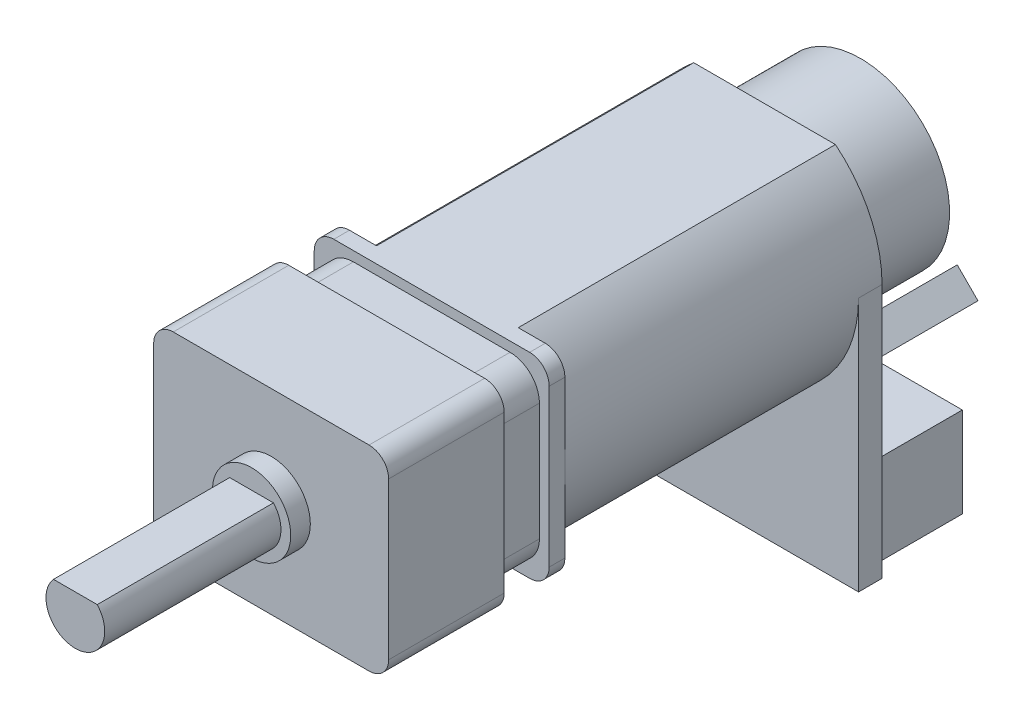
from build123d import *

# Parameters (mm, degrees)
MOTOR_DEPTH           = 15
GEARBOX_DEPTH         = 9
CUT_EXTRUDE1_START    = 0.8
SKETCH6_OUTSIDE_W     = 19.728
SKETCH6_OUTSIDE_H     = 17.728
CUT_EXTRUDE1_DEPTH    = 2.3
SKETCH5_R             = 2
GEARBOX_BEARING_DEPTH = 1
SHAFT_START           = 1
SHAFT_DEPTH           = 9
ENCODER_BASE_START    = -6.1
ENCODER_BASE_DEPTH    = 6.1
SKETCH7_OUTSIDE_W     = 23.112
SKETCH7_OUTSIDE_H     = 29.112
SKETCH7_OUTSIDE_R     = 4.55
SKETCH7_OUTSIDE_W_2   = 10.4
SKETCH7_OUTSIDE_H_2   = 4.6
CUT_EXTRUDE3_DEPTH    = 4.9
SKETCH8_W             = 9.6
SKETCH8_H             = 4.1
CUT_EXTRUDE4_DEPTH    = 3.84


with BuildPart() as part:
    # Sketch1 → motor (new body)
    with BuildSketch(Plane.XY):
        with BuildLine():
            Line((-3.62, 5), (3.62, 5))
            ThreePointArc((3.62, 5), (6, 0), (3.62, -5))
            Line((3.62, -5), (-3.62, -5))
            ThreePointArc((-3.62, -5), (-6, 0), (-3.62, 5))
        make_face()
    extrude(amount=MOTOR_DEPTH)

    # Sketch3 → gearbox (add)
    with BuildSketch(Plane.XY.offset(15)):
        with BuildLine():
            Line((-5, -5), (5, -5))
            ThreePointArc((5, -5), (5.707106781, -4.707106781), (6, -4))
            Line((6, -4), (6, 4))
            ThreePointArc((6, 4), (5.707106781, 4.707106781), (5, 5))
            Line((5, 5), (-5, 5))
            ThreePointArc((-5, 5), (-5.707106781, 4.707106781), (-6, 4))
            Line((-6, 4), (-6, -4))
            ThreePointArc((-6, -4), (-5.707106781, -4.707106781), (-5, -5))
        make_face()
    extrude(amount=GEARBOX_DEPTH)

    # Sketch6 outside → Cut-Extrude1 (cut)
    with BuildSketch(Plane.XY.offset(15).offset(CUT_EXTRUDE1_START)):
        Rectangle(SKETCH6_OUTSIDE_W, SKETCH6_OUTSIDE_H)
        with BuildLine():
            Line((-4, 4.5), (4, 4.5))
            ThreePointArc((4, 4.5), (5.060660172, 4.060660172), (5.5, 3))
            Line((5.5, 3), (5.5, -3))
            ThreePointArc((5.5, -3), (5.060660172, -4.060660172), (4, -4.5))
            Line((4, -4.5), (-4, -4.5))
            ThreePointArc((-4, -4.5), (-5.060660172, -4.060660172), (-5.5, -3))
            Line((-5.5, -3), (-5.5, 3))
            ThreePointArc((-5.5, 3), (-5.060660172, 4.060660172), (-4, 4.5))
        make_face(mode=Mode.SUBTRACT)
    extrude(amount=CUT_EXTRUDE1_DEPTH, mode=Mode.SUBTRACT)

    # Sketch5 → gearbox-bearing (add)
    with BuildSketch(Plane.XY.offset(24)):
        Circle(SKETCH5_R)
    extrude(amount=GEARBOX_BEARING_DEPTH)

    # Sketch4 → shaft (add)
    with BuildSketch(Plane.XY.offset(24).offset(SHAFT_START)):
        with BuildLine():
            Line((-1.118033989, 1), (1.118033989, 1))
            ThreePointArc((1.118033989, 1), (0, -1.5), (-1.118033989, 1))
        make_face()
    extrude(amount=SHAFT_DEPTH)

    # Sketch2 → encoder-base (add)
    with BuildSketch(Plane.XY.offset(ENCODER_BASE_START)):
        with BuildLine():
            Line((6, 0), (6, -13))
            Line((6, -13), (-6, -13))
            Line((-6, -13), (-6, 0))
            ThreePointArc((-6, 0), (-5.37464767, 2.768772291), (-3.62, 5))
            Line((-3.62, 5), (3.62, 5))
            ThreePointArc((3.62, 5), (5.37464767, 2.768772291), (6, 0))
        make_face()
    extrude(amount=ENCODER_BASE_DEPTH)

    # Sketch7 outside → Cut-Extrude3 (cut)
    with BuildSketch(Plane(origin=(0, 0, -6.1), x_dir=(-1, 0, 0), z_dir=(0, 0, -1))):
        with Locations((0, -4)):
            Rectangle(SKETCH7_OUTSIDE_W, SKETCH7_OUTSIDE_H)
        Circle(SKETCH7_OUTSIDE_R, mode=Mode.SUBTRACT)
        Polygon((4.939339828, -2.110912703), (2.110912703, -4.939339828), (3.171572875, -6), (6, -3.171572875), align=None, mode=Mode.SUBTRACT)
        Polygon((-2.110912703, -4.939339828), (-3.171572875, -6), (-6, -3.171572875), (-4.939339828, -2.110912703), align=None, mode=Mode.SUBTRACT)
        with Locations((0, -10.7)):
            Rectangle(SKETCH7_OUTSIDE_W_2, SKETCH7_OUTSIDE_H_2, mode=Mode.SUBTRACT)
    extrude(amount=-CUT_EXTRUDE3_DEPTH, mode=Mode.SUBTRACT)

    # Sketch8 → Cut-Extrude4 (cut)
    with BuildSketch(Plane.XZ.offset(13)):
        with Locations((0, -3.65)):
            Rectangle(SKETCH8_W, SKETCH8_H)
    extrude(amount=-CUT_EXTRUDE4_DEPTH, mode=Mode.SUBTRACT)


solid = part.part
